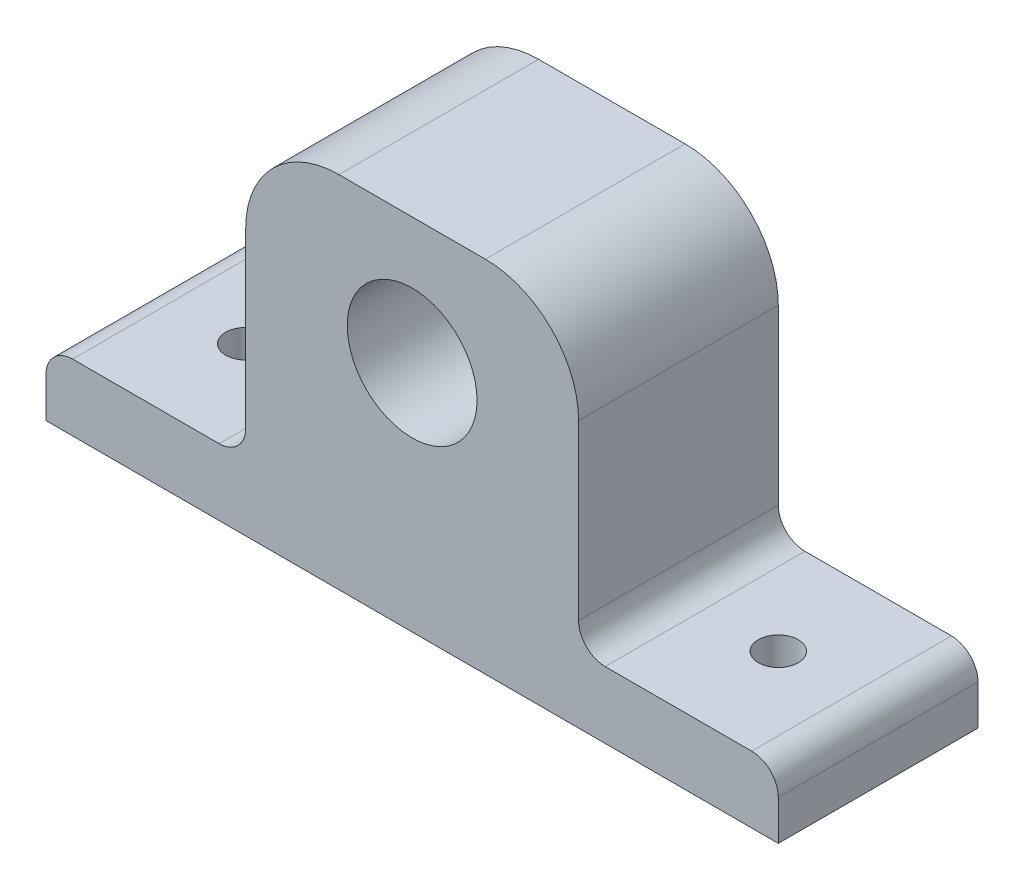
from build123d import *

# Parameters (mm, degrees)
SKETCH1_W               = 55
SKETCH1_H               = 15
BOSS_EXTRUDE1_DEPTH     = 27
CUT_EXTRUDE1_DEPTH      = 42.355168964
CUT_EXTRUDE1_DEPTH_BACK = 42.355168964
SKETCH2_R               = 4.875
SKETCH4_W               = 15
SKETCH4_H               = 15
CUT_EXTRUDE2_DEPTH      = 22
CUT_EXTRUDE3_DEPTH      = 37.006943775
CUT_EXTRUDE3_DEPTH_BACK = 37.006943775
SKETCH5_R               = 1.5
FILLET1_R               = 2
FILLET2_R               = 7


with BuildPart() as part:
    # Sketch1 → Boss-Extrude1 (new body)
    with BuildSketch(Plane(origin=(0, 0, 0), x_dir=(1, 0, 0), z_dir=(0, 1, 0))):
        Rectangle(SKETCH1_W, SKETCH1_H)
    extrude(amount=BOSS_EXTRUDE1_DEPTH)

    # Sketch2 → Cut-Extrude1 (cut, two sides: drawn at the far end of the back side and taken through both)
    with BuildSketch(Plane.XY.offset(7.5).offset(-CUT_EXTRUDE1_DEPTH_BACK)):
        with Locations((0, 17.5)):
            Circle(SKETCH2_R)
    extrude(amount=CUT_EXTRUDE1_DEPTH + CUT_EXTRUDE1_DEPTH_BACK, mode=Mode.SUBTRACT)

    # Sketch4 → Cut-Extrude2 (cut)
    with BuildSketch(Plane(origin=(0, 27, 0), x_dir=(1, 0, 0), z_dir=(0, 1, 0))):
        with Locations((-20, 0)):
            Rectangle(SKETCH4_W, SKETCH4_H)
        with Locations((20, 0)):
            Rectangle(SKETCH4_W, SKETCH4_H)
    extrude(amount=-CUT_EXTRUDE2_DEPTH, mode=Mode.SUBTRACT)

    # Sketch5 → Cut-Extrude3 (cut, two sides: drawn at the far end of the back side and taken through both)
    with BuildSketch(Plane(origin=(0, 5, 0), x_dir=(1, 0, 0), z_dir=(0, 1, 0)).offset(-CUT_EXTRUDE3_DEPTH_BACK)):
        with Locations(Location((-20, 0, 0), (0, 0, 270))):
            Circle(SKETCH5_R)
        with Locations(Location((20, 0, 0), (0, 0, 270))):
            Circle(SKETCH5_R)
    extrude(amount=CUT_EXTRUDE3_DEPTH + CUT_EXTRUDE3_DEPTH_BACK, mode=Mode.SUBTRACT)

    # Fillet1
    fillet1_edges = [part.edges().sort_by_distance(p)[0] for p in [
        (-27.5, 5, 0),
        (-12.5, 5, 0),
        (27.5, 5, 0),
        (12.5, 5, 0),
    ]]
    fillet(fillet1_edges, radius=FILLET1_R)

    # Fillet2
    fillet2_edges = [part.edges().sort_by_distance(p)[0] for p in [
        (-12.5, 27, 0),
        (12.5, 27, 0),
    ]]
    fillet(fillet2_edges, radius=FILLET2_R)


solid = part.part
